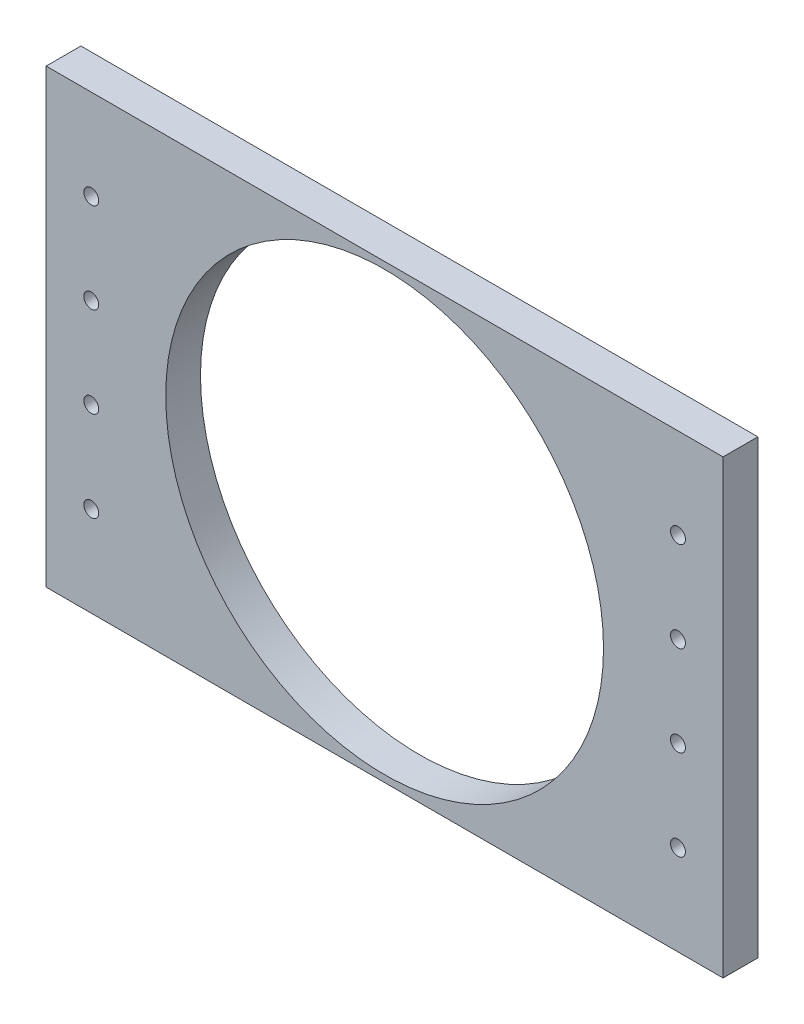
from build123d import *

# Parameters (mm, degrees)
SKETCH_1_W      = 150
SKETCH_1_H      = 100
SKETCH_1_R      = 1.65
SKETCH_1_R_2    = 48.5
EXTRUDE_1_DEPTH = 7.7


with BuildPart() as part:
    # 草图1 → 凸台-拉伸1 (new body)
    with BuildSketch(Plane.XY):
        Rectangle(SKETCH_1_W, SKETCH_1_H)
        with Locations(Location((-65, 30, 0), (0, 0, 180))):
            Circle(SKETCH_1_R, mode=Mode.SUBTRACT)
        with Locations(Location((-65, 10, 0), (0, 0, 180))):
            Circle(SKETCH_1_R, mode=Mode.SUBTRACT)
        with Locations(Location((-65, -10, 0), (0, 0, 180))):
            Circle(SKETCH_1_R, mode=Mode.SUBTRACT)
        with Locations(Location((-65, -30, 0), (0, 0, 180))):
            Circle(SKETCH_1_R, mode=Mode.SUBTRACT)
        with Locations(Location((65, -30, 0), (0, 0, 180))):
            Circle(SKETCH_1_R, mode=Mode.SUBTRACT)
        with Locations(Location((65, -10, 0), (0, 0, 180))):
            Circle(SKETCH_1_R, mode=Mode.SUBTRACT)
        with Locations(Location((65, 10, 0), (0, 0, 180))):
            Circle(SKETCH_1_R, mode=Mode.SUBTRACT)
        with Locations(Location((65, 30, 0), (0, 0, 180))):
            Circle(SKETCH_1_R, mode=Mode.SUBTRACT)
        with Locations(Location((0, 0, 0), (0, 0, 180))):
            Circle(SKETCH_1_R_2, mode=Mode.SUBTRACT)
    extrude(amount=EXTRUDE_1_DEPTH)


solid = part.part
